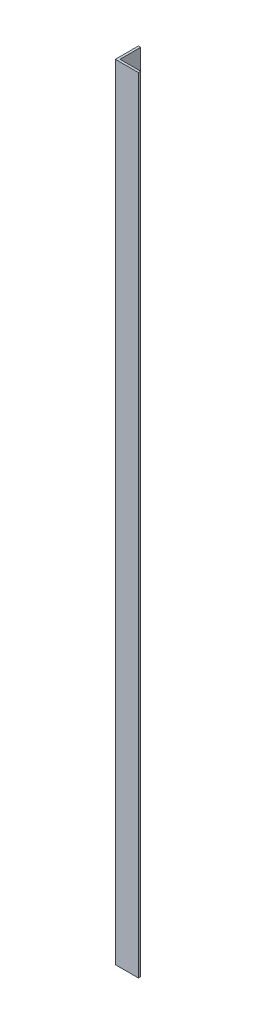
from build123d import *

# Parameters (mm, degrees)
BOSS_EXTRUDE1_DEPTH = 2165.35


with BuildPart() as part:
    # Sketch1 → Boss-Extrude1 (new body)
    with BuildSketch(Plane(origin=(0, 0, 0), x_dir=(1, 0, 0), z_dir=(0, 1, 0))):
        Polygon((0, 0), (0, 63.5), (6.35, 63.5), (6.35, 6.35), (63.5, 6.35), (63.5, 0), align=None)
    extrude(amount=BOSS_EXTRUDE1_DEPTH)


solid = part.part
